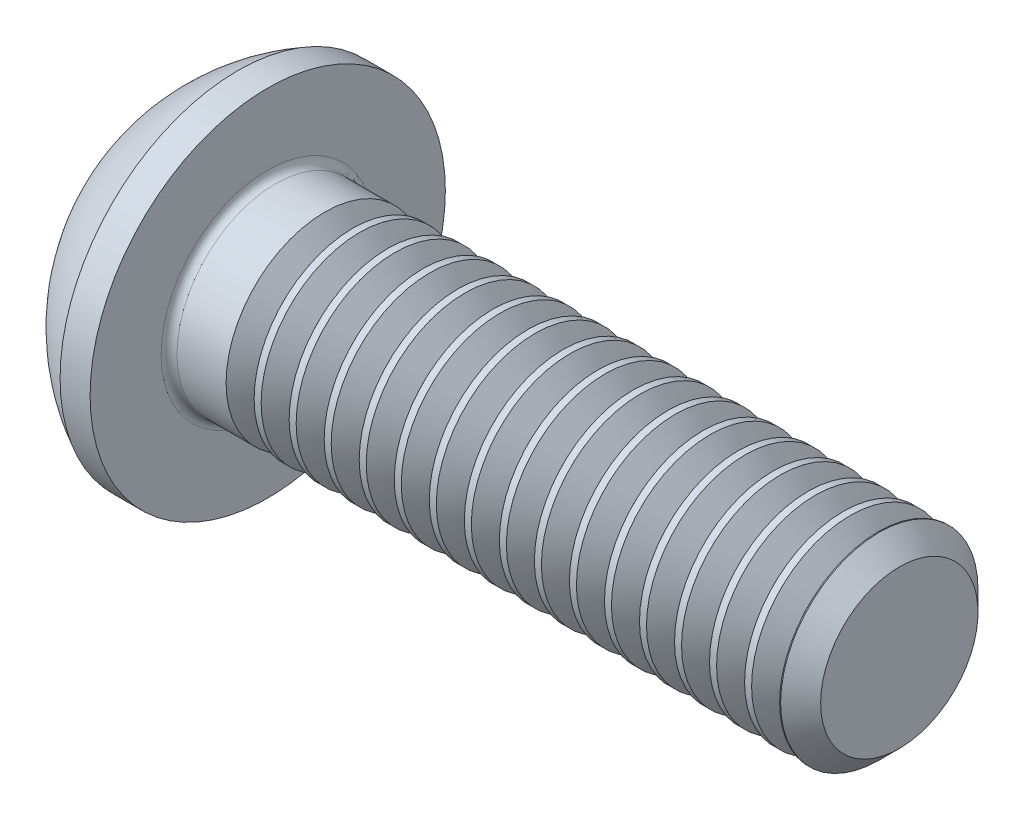
from build123d import *

# Parameters (mm, degrees)
FILLET1_R       = 0.1
HEX_2_DEPTH     = 0.8
THDSCHPAT_COUNT = 16
THDSCHPAT_PITCH = 0.44375


with BuildPart() as part:
    # BodySke → BaseBody (revolve)
    with BuildSketch(Plane.XY, mode=Mode.PRIVATE) as basebody_sk:
        with BuildLine():
            Line((9.5, 0), (9.5, 0.9965))
            Line((9.5, 0.9965), (9.2465, 1.25))
            Line((9.2465, 1.25), (1.5, 1.25))
            Line((1.5, 1.25), (1.5, 2.25))
            Line((1.5, 2.25), (1.12, 2.25))
            ThreePointArc((1.12, 2.25), (0.469103821, 1.777992196), (0, 1.125))
            Line((0, 1.125), (0, 0))
            Line((0, 0), (9.5, 0))
        make_face()
    revolve(basebody_sk.sketch.rotate(Axis((0, 0, 0), (1, 0, 0)), 90), axis=Axis((0, 0, 0), (1, 0, 0)))

    # Fillet1
    fillet1_edges = [part.edges().sort_by_distance(p)[0] for p in [
        (1.5, 0, -1.25),
    ]]
    fillet(fillet1_edges, radius=FILLET1_R)

    # Sketch2 → PreBroach (revolve, cut)
    with BuildSketch(Plane.XY, mode=Mode.PRIVATE) as prebroach_sk:
        Polygon((0, 0.75), (0.8, 0.75), (1.233012702, 0), (0, 0), align=None)
    revolve(prebroach_sk.sketch.rotate(Axis((0, 0, 0), (1, 0, 0)), 90), axis=Axis((0, 0, 0), (1, 0, 0)), mode=Mode.SUBTRACT)

    # Sketch3 → Hex 2 (cut)
    with BuildSketch(Plane(origin=(0, 0, 0), x_dir=(0, 0, -1), z_dir=(1, 0, 0))):
        Polygon((-0.75, -0.433012702), (-0.75, 0.433012702), (0, 0.866025404), (0.75, 0.433012702), (0.75, -0.433012702), (0, -0.866025404), align=None)
    extrude(amount=HEX_2_DEPTH, mode=Mode.SUBTRACT)

    # ThdSchSke → ThreadSchematic (revolve, cut)
    with BuildSketch(Plane.XY, mode=Mode.PRIVATE) as threadschematic_sk:
        Polygon((2.4, -0.9965), (2.222497389, -1.25), (2.222497389, -1.5625), (2.577502611, -1.5625), (2.577502611, -1.25), align=None)
    threadschematic = revolve(threadschematic_sk.sketch.rotate(Axis((-3.175, 0, 0), (1, 0, 0)), 270), axis=Axis((-3.175, 0, 0), (1, 0, 0)), mode=Mode.SUBTRACT)

    # ThdSchPat: ThreadSchematic ×16
    with Locations(*[(i * THDSCHPAT_PITCH, 0, 0) for i in range(1, THDSCHPAT_COUNT)]):
        add(threadschematic, mode=Mode.SUBTRACT)


solid = part.part
